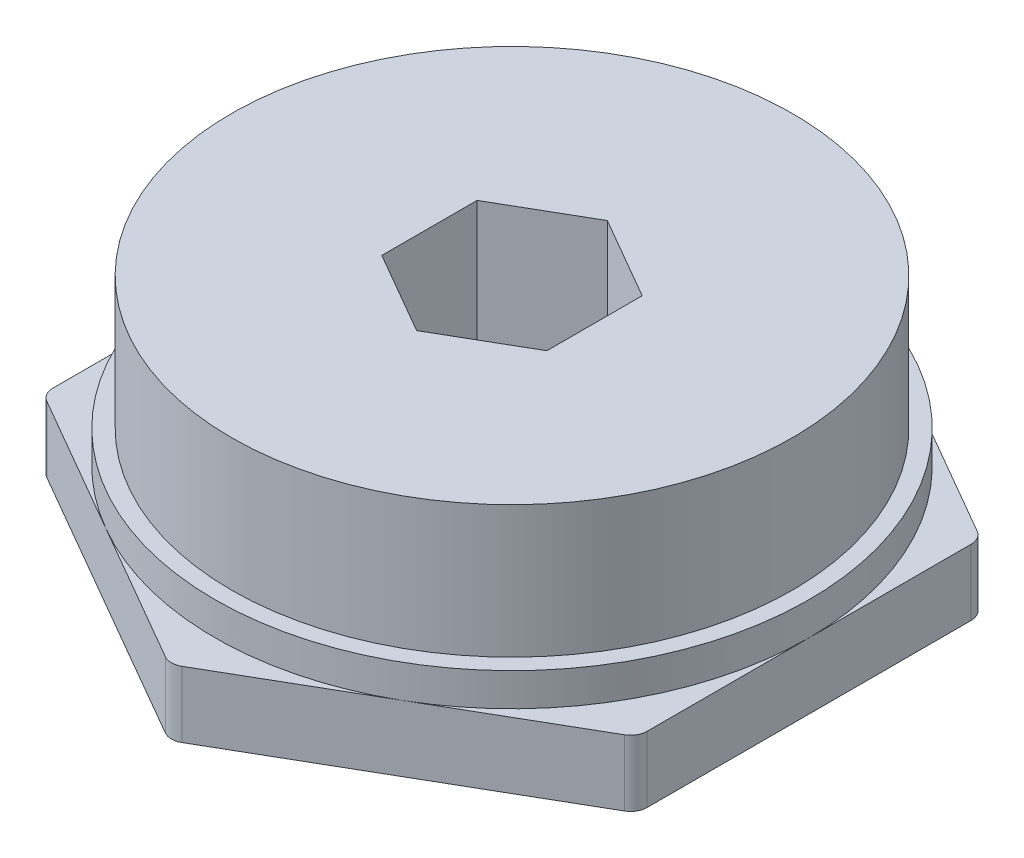
from build123d import *

# Parameters (mm, degrees)
BOSS_EXTRUDE1_DEPTH = 2
FILLET1_R           = 0.5
SKETCH2_R           = 9
BOSS_EXTRUDE2_DEPTH = 1
SKETCH3_R           = 8.5
BOSS_EXTRUDE3_DEPTH = 4
CUT_EXTRUDE1_DEPTH  = 16.375249198


with BuildPart() as part:
    # Sketch1 → Boss-Extrude1 (new body)
    with BuildSketch(Plane(origin=(0, 31, 0), x_dir=(1, 0, 0), z_dir=(0, 1, 0))):
        Polygon((0, 10.392304845), (-9, 5.196152423), (-9, -5.196152423), (0, -10.392304845), (9, -5.196152423), (9, 5.196152423), align=None)
    extrude(amount=BOSS_EXTRUDE1_DEPTH)

    # Fillet1
    fillet1_edges = [part.edges().sort_by_distance(p)[0] for p in [
        (9, 32, -5.196152423),
        (9, 32, 5.196152423),
        (0, 32, 10.392304845),
        (-9, 32, 5.196152423),
        (-9, 32, -5.196152423),
        (0, 32, -10.392304845),
    ]]
    fillet(fillet1_edges, radius=FILLET1_R)

    # Sketch2 → Boss-Extrude2 (add)
    with BuildSketch(Plane(origin=(0, 33, 0), x_dir=(1, 0, 0), z_dir=(0, 1, 0))):
        with Locations(Location((0, 0, 0), (0, 0, 60))):
            Circle(SKETCH2_R)
    extrude(amount=BOSS_EXTRUDE2_DEPTH)

    # Sketch3 → Boss-Extrude3 (add)
    with BuildSketch(Plane(origin=(0, 34, 0), x_dir=(1, 0, 0), z_dir=(0, 1, 0))):
        with Locations(Location((0, 0, 0), (0, 0, 270))):
            Circle(SKETCH3_R)
    extrude(amount=BOSS_EXTRUDE3_DEPTH)

    # Sketch4 → Cut-Extrude1 (cut, through all)
    with BuildSketch(Plane(origin=(0, 38, 0), x_dir=(1, 0, 0), z_dir=(0, 1, 0))):
        Polygon((0, 2.886751346), (-2.5, 1.443375673), (-2.5, -1.443375673), (0, -2.886751346), (2.5, -1.443375673), (2.5, 1.443375673), align=None)
    extrude(amount=-CUT_EXTRUDE1_DEPTH, mode=Mode.SUBTRACT)


solid = part.part
